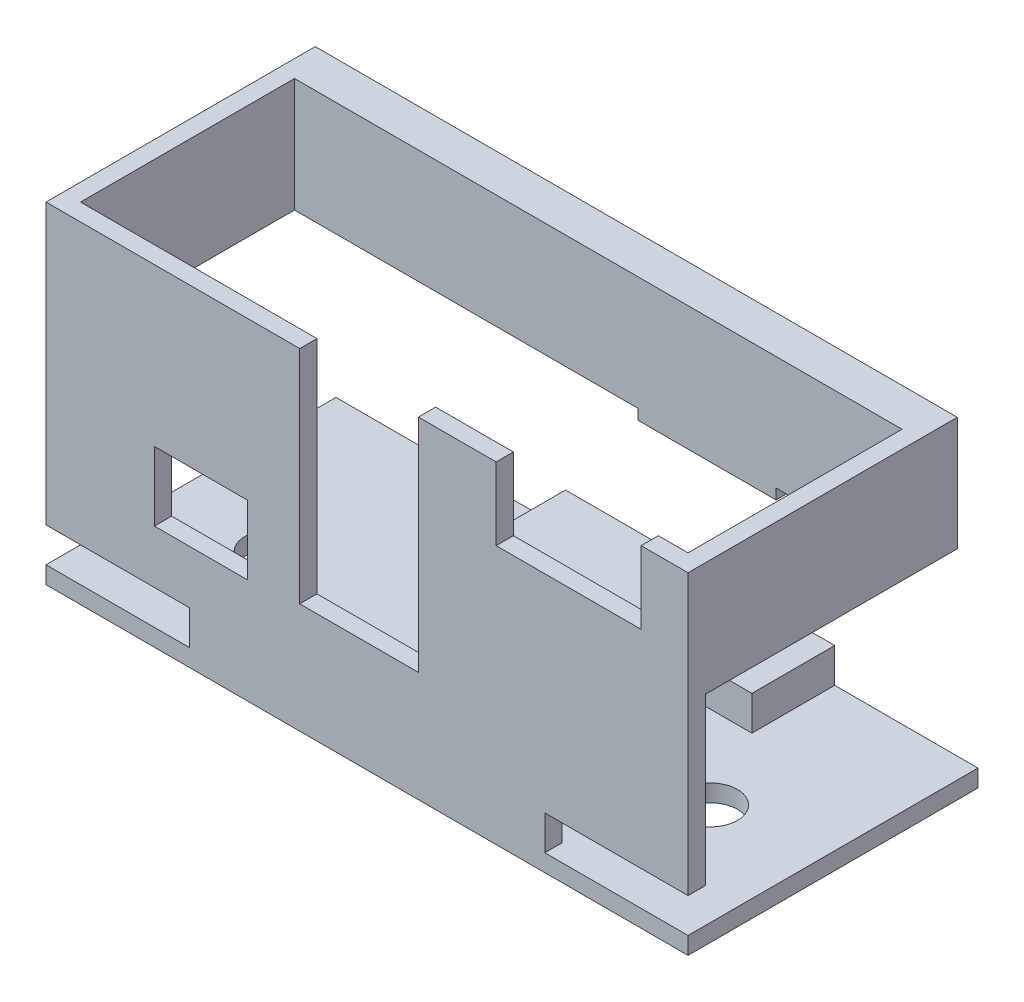
from build123d import *

# Parameters (mm, degrees)
SKETCH1_W               = 46.5
SKETCH1_H               = 24
BOSS_EXTRUDE1_DEPTH     = 21
SHELL1_T                = -1.25
SKETCH2_W               = 19.75
SKETCH2_H               = 14.5
CUT_EXTRUDE1_DEPTH      = 57.384838388
CUT_EXTRUDE4_REACH      = 57.358
SKETCH6_R               = 1.95
CUT_EXTRUDE5_REACH      = 57.358
SKETCH7_W               = 10.375
SKETCH7_H               = 2.5
SKETCH9_W               = 19.5
SKETCH9_H               = 6
BOSS_EXTRUDE3_DEPTH     = 2.5
CUT_EXTRUDE7_DEPTH      = 102.634838388
CUT_EXTRUDE7_DEPTH_BACK = 57.384838388
CUT_EXTRUDE7_START      = -45.25
SKETCH12_W              = 1.5
SKETCH12_H              = 8.25
SKETCH13_W              = 2.75
SKETCH13_H              = 8.25
BOSS_EXTRUDE4_DEPTH     = 44
SKETCH15_W              = 10
SKETCH15_H              = 2.75
BOSS_EXTRUDE5_DEPTH     = 0.75
CUT_EXTRUDE8_REACH      = 57.358
SKETCH18_W              = 6.76
SKETCH18_H              = 5
CUT_EXTRUDE9_REACH      = 57.358
SKETCH22_W              = 8.593751287
SKETCH22_H              = 16.011767213
CUT_EXTRUDE15_REACH     = 57.358
SKETCH25_W              = 10
SKETCH25_H              = 4.5


with BuildPart() as part:
    # Sketch1 → Boss-Extrude1 (new body)
    with BuildSketch(Plane.XY):
        with Locations((22, 12)):
            Rectangle(SKETCH1_W, SKETCH1_H)
    extrude(amount=-BOSS_EXTRUDE1_DEPTH)

    # Shell1
    shell1_openings = [part.faces().sort_by_distance(p)[0] for p in [
        (22, 12, -21),
        (22, 24, -10.5),
    ]]
    offset(amount=SHELL1_T, openings=shell1_openings, kind=Kind.INTERSECTION)

    # Sketch2 → Cut-Extrude1 (cut, through all)
    with BuildSketch(Plane.ZY.offset(1.25)):
        with Locations((-11.125, 8.5)):
            Rectangle(SKETCH2_W, SKETCH2_H)
    extrude(amount=-CUT_EXTRUDE1_DEPTH, mode=Mode.SUBTRACT)

    # Sketch6 → Cut-Extrude4 (cut, up to next)
    with BuildSketch(Plane(origin=(0, 0, 0), x_dir=(-1, 0, 0), z_dir=(0, -1, 0)), mode=Mode.PRIVATE) as cut_extrude4_sk1:
        with Locations(Location((-6.125, 9, 0), (0, 0, 90))):
            Circle(SKETCH6_R)
    cut_extrude4_tool1 = extrude(cut_extrude4_sk1.sketch, amount=-CUT_EXTRUDE4_REACH, mode=Mode.PRIVATE) & part.part
    # Sketch6 → Cut-Extrude4 (cut, up to next)
    with BuildSketch(Plane(origin=(0, 0, 0), x_dir=(-1, 0, 0), z_dir=(0, -1, 0)), mode=Mode.PRIVATE) as cut_extrude4_sk2:
        with Locations(Location((-37.875, 9, 0), (0, 0, 90))):
            Circle(SKETCH6_R)
    cut_extrude4_tool2 = extrude(cut_extrude4_sk2.sketch, amount=-CUT_EXTRUDE4_REACH, mode=Mode.PRIVATE) & part.part
    add(cut_extrude4_tool1.solids().sort_by_distance((6.125, 0, -9))[0], mode=Mode.SUBTRACT)
    add(cut_extrude4_tool2.solids().sort_by_distance((37.875, 0, -9))[0], mode=Mode.SUBTRACT)

    # Sketch7 → Cut-Extrude5 (cut, up to next)
    with BuildSketch(Plane.XY, mode=Mode.PRIVATE) as cut_extrude5_sk1:
        with Locations((40.0625, 2.5)):
            Rectangle(SKETCH7_W, SKETCH7_H)
    cut_extrude5_tool1 = extrude(cut_extrude5_sk1.sketch, amount=-CUT_EXTRUDE5_REACH, mode=Mode.PRIVATE) & part.part
    # Sketch7 → Cut-Extrude5 (cut, up to next)
    with BuildSketch(Plane.XY, mode=Mode.PRIVATE) as cut_extrude5_sk2:
        with Locations((3.9375, 2.5)):
            Rectangle(SKETCH7_W, SKETCH7_H)
    cut_extrude5_tool2 = extrude(cut_extrude5_sk2.sketch, amount=-CUT_EXTRUDE5_REACH, mode=Mode.PRIVATE) & part.part
    add(cut_extrude5_tool1.solids().sort_by_distance((40.0625, 2.5, 0))[0], mode=Mode.SUBTRACT)
    add(cut_extrude5_tool2.solids().sort_by_distance((3.9375, 2.5, 0))[0], mode=Mode.SUBTRACT)

    # Sketch9 → Boss-Extrude3 (add)
    with BuildSketch(Plane(origin=(0, 1.25, 0), x_dir=(1, 0, 0), z_dir=(0, 1, 0))):
        with Locations((25.125, 18)):
            Rectangle(SKETCH9_W, SKETCH9_H)
    extrude(amount=BOSS_EXTRUDE3_DEPTH)

    # Sketch12 → Cut-Extrude7 (cut, two sides: drawn at the far end of the back side and taken through both)
    with BuildSketch(Plane(origin=(45.25, 0, 0), x_dir=(0, 0, -1), z_dir=(1, 0, 0)).offset(CUT_EXTRUDE7_START - CUT_EXTRUDE7_DEPTH_BACK)):
        with Locations((20.25, 19.875)):
            Rectangle(SKETCH12_W, SKETCH12_H)
    extrude(amount=CUT_EXTRUDE7_DEPTH + CUT_EXTRUDE7_DEPTH_BACK, mode=Mode.SUBTRACT)

    # Sketch13 → Boss-Extrude4 (add)
    with BuildSketch(Plane(origin=(0, 0, 0), x_dir=(0, 0, -1), z_dir=(1, 0, 0))):
        with Locations((18.125, 19.875)):
            Rectangle(SKETCH13_W, SKETCH13_H)
    extrude(amount=BOSS_EXTRUDE4_DEPTH)

    # Sketch15 → Boss-Extrude5 (add)
    with BuildSketch(Plane.XZ.offset(-15.75)):
        with Locations((29.875, -18.125)):
            Rectangle(SKETCH15_W, SKETCH15_H)
    extrude(amount=BOSS_EXTRUDE5_DEPTH)

    # Sketch18 → Cut-Extrude8 (cut, up to next)
    with BuildSketch(Plane.XY, mode=Mode.PRIVATE) as cut_extrude8_sk1:
        with Locations((9.98, 10.1)):
            Rectangle(SKETCH18_W, SKETCH18_H)
    cut_extrude8_tool1 = extrude(cut_extrude8_sk1.sketch, amount=-CUT_EXTRUDE8_REACH, mode=Mode.PRIVATE) & part.part
    add(cut_extrude8_tool1.solids().sort_by_distance((9.98, 10.1, 0))[0], mode=Mode.SUBTRACT)

    # Sketch22 → Cut-Extrude9 (cut, up to next)
    with BuildSketch(Plane.XY, mode=Mode.PRIVATE) as cut_extrude9_sk1:
        with Locations((21.422492142, 15.994116394)):
            Rectangle(SKETCH22_W, SKETCH22_H)
    cut_extrude9_tool1 = extrude(cut_extrude9_sk1.sketch, amount=-CUT_EXTRUDE9_REACH, mode=Mode.PRIVATE) & part.part
    add(cut_extrude9_tool1.solids().sort_by_distance((21.422492, 15.994116, 0))[0], mode=Mode.SUBTRACT)

    # Sketch25 → Cut-Extrude15 (cut, up to next)
    with BuildSketch(Plane.XY, mode=Mode.PRIVATE) as cut_extrude15_sk1:
        Polygon((31.35, 18.75), (41.85, 18.75), (41.85, 24), (41.6, 24), (41.6, 19.5), (31.6, 19.5), (31.6, 24), (31.35, 24), align=None)
    cut_extrude15_tool1 = extrude(cut_extrude15_sk1.sketch, amount=-CUT_EXTRUDE15_REACH, mode=Mode.PRIVATE) & part.part
    # Sketch25 → Cut-Extrude15 (cut, up to next)
    with BuildSketch(Plane.XY, mode=Mode.PRIVATE) as cut_extrude15_sk2:
        with Locations((36.6, 21.75)):
            Rectangle(SKETCH25_W, SKETCH25_H)
    cut_extrude15_tool2 = extrude(cut_extrude15_sk2.sketch, amount=-CUT_EXTRUDE15_REACH, mode=Mode.PRIVATE) & part.part
    add(cut_extrude15_tool1.solids().sort_by_distance((31.475, 23.882606, 0))[0], mode=Mode.SUBTRACT)
    add(cut_extrude15_tool2.solids().sort_by_distance((36.6, 21.75, 0))[0], mode=Mode.SUBTRACT)


solid = part.part
